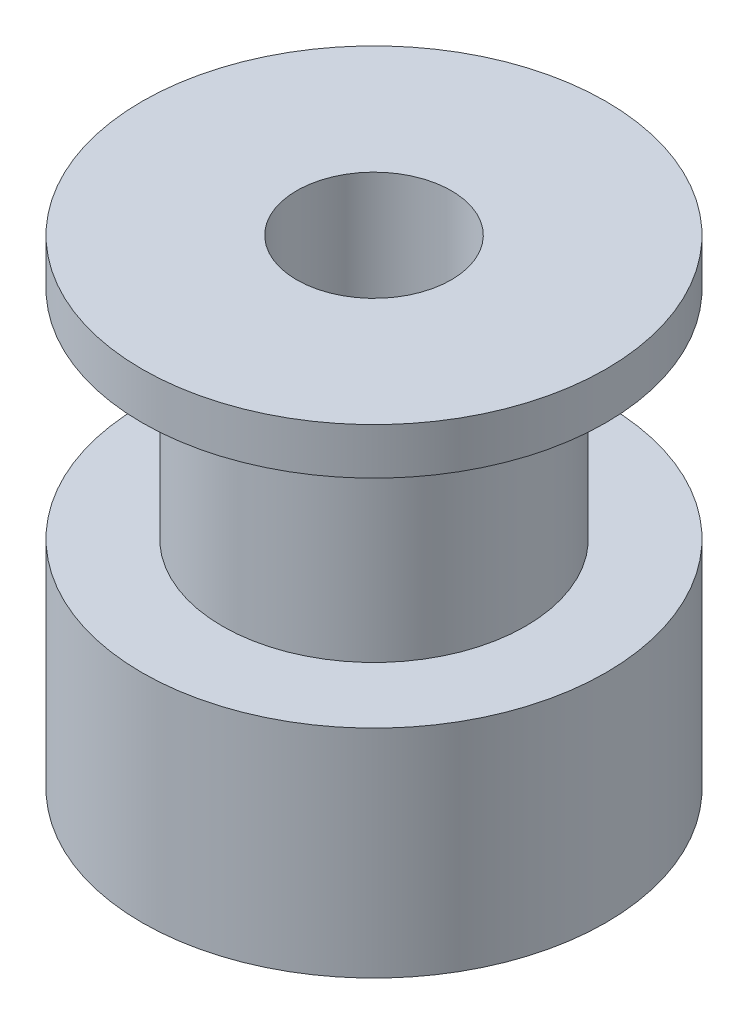
from build123d import *

# Parameters (mm, degrees)
SKETCH1_R           = 7.5
BOSS_EXTRUDE1_DEPTH = 7
SKETCH2_R           = 4.9
BOSS_EXTRUDE2_DEPTH = 7
SKETCH3_R           = 7.5
BOSS_EXTRUDE3_DEPTH = 1.5
SKETCH4_R           = 2.5
CUT_EXTRUDE1_DEPTH  = 19.781639971


with BuildPart() as part:
    # Sketch1 → Boss-Extrude1 (new body)
    with BuildSketch(Plane(origin=(0, 0, 0), x_dir=(1, 0, 0), z_dir=(0, 1, 0))):
        with Locations(Location((0, 0, 0), (0, 0, 270))):
            Circle(SKETCH1_R)
    extrude(amount=BOSS_EXTRUDE1_DEPTH)

    # Sketch2 → Boss-Extrude2 (add)
    with BuildSketch(Plane(origin=(0, 7, 0), x_dir=(1, 0, 0), z_dir=(0, 1, 0))):
        with Locations(Location((0, 0, 0), (0, 0, 270))):
            Circle(SKETCH2_R)
    extrude(amount=BOSS_EXTRUDE2_DEPTH)

    # Sketch3 → Boss-Extrude3 (add)
    with BuildSketch(Plane(origin=(0, 14, 0), x_dir=(1, 0, 0), z_dir=(0, 1, 0))):
        with Locations(Location((0, 0, 0), (0, 0, 270))):
            Circle(SKETCH3_R)
    extrude(amount=BOSS_EXTRUDE3_DEPTH)

    # Sketch4 → Cut-Extrude1 (cut, through all)
    with BuildSketch(Plane(origin=(0, 15.5, 0), x_dir=(1, 0, 0), z_dir=(0, 1, 0))):
        with Locations(Location((0, 0, 0), (0, 0, 270))):
            Circle(SKETCH4_R)
    extrude(amount=-CUT_EXTRUDE1_DEPTH, mode=Mode.SUBTRACT)


solid = part.part
